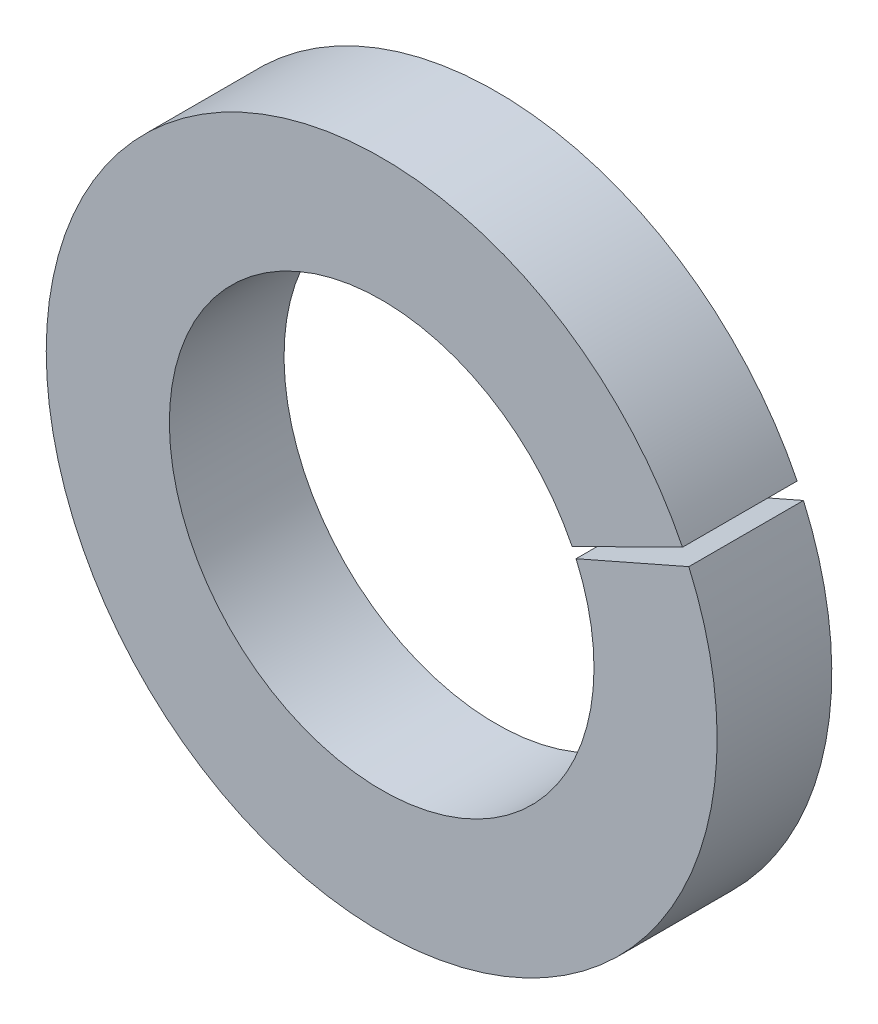
from build123d import *

# Parameters (mm, degrees)
SKETCH_1_R          = 7.9
SKETCH_1_R_2        = 5
EXTRUDE_1_DEPTH     = 2.7
CUT_EXTRUDE_1_DEPTH = 10


with BuildPart() as part:
    # 草图1 → 凸台-拉伸1 (new body)
    with BuildSketch(Plane.XY):
        with Locations(Location((0, 0, 0), (0, 0, 180))):
            Circle(SKETCH_1_R)
        with Locations(Location((0, 0, 0), (0, 0, 180))):
            Circle(SKETCH_1_R_2, mode=Mode.SUBTRACT)
    extrude(amount=EXTRUDE_1_DEPTH)

    # 草图2 → 切除-拉伸1 (cut)
    with BuildSketch(Plane.XY.offset(2.7)):
        Polygon((0, 0), (8.171451681, 4.033670186), (8.171451681, 3.587869008), align=None)
    extrude(amount=-CUT_EXTRUDE_1_DEPTH, mode=Mode.SUBTRACT)


solid = part.part
